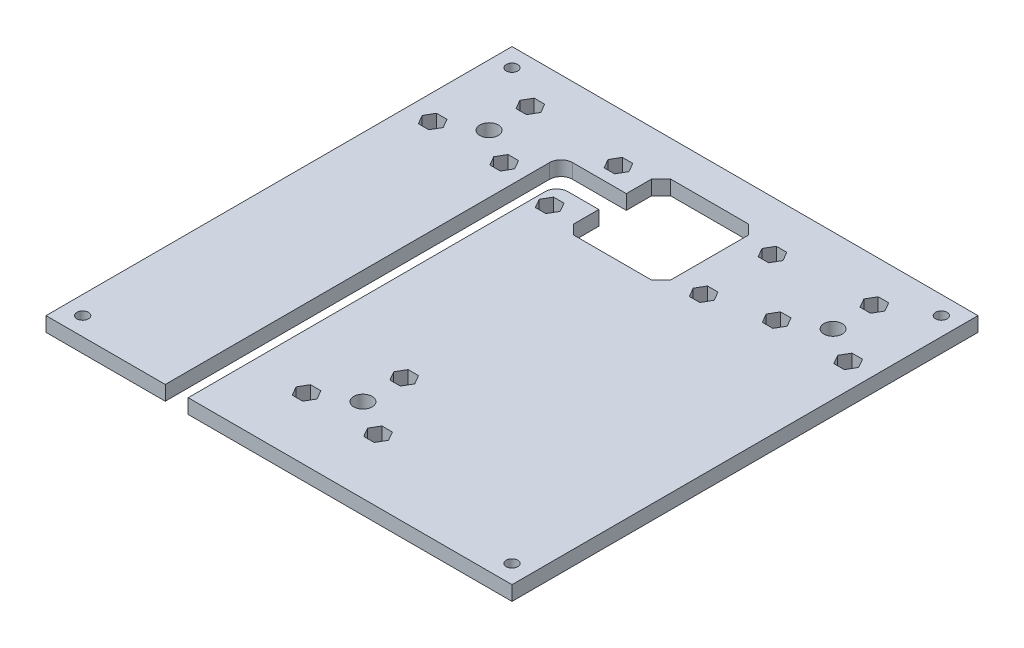
from build123d import *

# Parameters (mm, degrees)
ESQUISSE1_W              = 203.2
ESQUISSE1_H              = 203.2
BOSS_EXTRU_1_DEPTH       = 6.35
ESQUISSE2_R              = 4
ENL_V_MAT_EXTRU_1_DEPTH  = 144.824345992
ENL_V_MAT_EXTRU_2_DEPTH  = 144.824345992
ENL_V_MAT_EXTRU_3_DEPTH  = 144.824345992
CONG_1_R                 = 5
ENL_V_MAT_EXTRU_5_DEPTH  = 144.824345992
ENL_V_MAT_EXTRU_6_DEPTH  = 144.824345992
ENL_V_MAT_EXTRU_7_DEPTH  = 144.824345992
ENL_V_MAT_EXTRU_8_DEPTH  = 144.824345992
ENL_V_MAT_EXTRU_9_DEPTH  = 144.824345992
ESQUISSE11_R             = 2.5
ENL_V_MAT_EXTRU_10_DEPTH = 144.824345992


with BuildPart() as part:
    # Esquisse1 → Boss.-Extru.1 (new body)
    with BuildSketch(Plane(origin=(0, 0, 0), x_dir=(1, 0, 0), z_dir=(0, 1, 0))):
        Rectangle(ESQUISSE1_W, ESQUISSE1_H)
    extrude(amount=BOSS_EXTRU_1_DEPTH)

    # Esquisse2 → Enlèv. mat.-Extru.1 (cut, through all)
    with BuildSketch(Plane(origin=(0, 6.35, 0), x_dir=(1, 0, 0), z_dir=(0, 1, 0))):
        with Locations(Location((-75, 65, 0), (0, 0, 270))):
            Circle(ESQUISSE2_R)
        with Locations(Location((75, 65, 0), (0, 0, 270))):
            Circle(ESQUISSE2_R)
        with Locations(Location((0, -65, 0), (0, 0, 270))):
            Circle(ESQUISSE2_R)
    extrude(amount=-ENL_V_MAT_EXTRU_1_DEPTH, mode=Mode.SUBTRACT)

    # Esquisse3 → Enlèv. mat.-Extru.2 (cut, through all)
    with BuildSketch(Plane(origin=(0, 6.35, 0), x_dir=(1, 0, 0), z_dir=(0, 1, 0))):
        Polygon((-17.05, 86.15), (-21.15, 82.05), (-21.15, 47.95), (-17.05, 43.85), (17.05, 43.85), (21.15, 47.95), (21.15, 82.05), (17.05, 86.15), align=None)
    extrude(amount=-ENL_V_MAT_EXTRU_2_DEPTH, mode=Mode.SUBTRACT)

    # Esquisse4 → Enlèv. mat.-Extru.3 (cut, through all)
    with BuildSketch(Plane(origin=(0, 6.35, 0), x_dir=(1, 0, 0), z_dir=(0, 1, 0))):
        Polygon((-49.6, -101.6), (-39.6, -101.6), (-39.6, 59), (-21.15, 59), (-21.15, 71), (-49.6, 71), align=None)
    extrude(amount=-ENL_V_MAT_EXTRU_3_DEPTH, mode=Mode.SUBTRACT)

    # Congé1
    cong_1_edges = [part.edges().sort_by_distance(p)[0] for p in [
        (-49.6, 3.175, -71),
        (-39.6, 3.175, -59),
    ]]
    fillet(cong_1_edges, radius=CONG_1_R)

    # Esquisse5 → Enlèv. mat.-Extru.5 (cut, through all)
    with BuildSketch(Plane(origin=(0, 6.35, 0), x_dir=(1, 0, 0), z_dir=(0, 1, 0))):
        Polygon((-28.852385868, 49.85), (-31.138692934, 45.89), (-35.711307066, 45.89), (-37.997614132, 49.85), (-35.711307066, 53.81), (-31.138692934, 53.81), align=None)
    extrude(amount=-ENL_V_MAT_EXTRU_5_DEPTH, mode=Mode.SUBTRACT)

    # Esquisse7 → Enlèv. mat.-Extru.6 (cut, through all)
    with BuildSketch(Plane(origin=(0, 6.35, 0), x_dir=(1, 0, 0), z_dir=(0, 1, 0))):
        Polygon((-31.138692934, 75.89), (-35.711307066, 75.89), (-37.997614132, 79.85), (-35.711307066, 83.81), (-31.138692934, 83.81), (-28.852385868, 79.85), align=None)
    extrude(amount=-ENL_V_MAT_EXTRU_6_DEPTH, mode=Mode.SUBTRACT)

    # Esquisse8 → Enlèv. mat.-Extru.7 (cut, through all)
    with BuildSketch(Plane(origin=(0, 6.35, 0), x_dir=(1, 0, 0), z_dir=(0, 1, 0))):
        Polygon((36.011307066, 45.89), (31.438692934, 45.89), (29.152385868, 49.85), (31.438692934, 53.81), (36.011307066, 53.81), (38.297614132, 49.85), align=None)
    extrude(amount=-ENL_V_MAT_EXTRU_7_DEPTH, mode=Mode.SUBTRACT)

    # Esquisse9 → Enlèv. mat.-Extru.8 (cut, through all)
    with BuildSketch(Plane(origin=(0, 6.35, 0), x_dir=(1, 0, 0), z_dir=(0, 1, 0))):
        Polygon((36.011307066, 75.89), (31.438692934, 75.89), (29.152385868, 79.85), (31.438692934, 83.81), (36.011307066, 83.81), (38.297614132, 79.85), align=None)
    extrude(amount=-ENL_V_MAT_EXTRU_8_DEPTH, mode=Mode.SUBTRACT)

    # Esquisse10 → Enlèv. mat.-Extru.9 (cut, through all)
    with BuildSketch(Plane(origin=(0, 6.35, 0), x_dir=(1, 0, 0), z_dir=(0, 1, 0))):
        Polygon((20.1610714, -74), (17.874764334, -70.04), (13.302150202, -70.04), (11.015843136, -74), (13.302150202, -77.96), (17.874764334, -77.96), align=None)
        Polygon((-20.1610714, -74), (-17.874764334, -77.96), (-13.302150202, -77.96), (-11.015843136, -74), (-13.302150202, -70.04), (-17.874764334, -70.04), align=None)
        Polygon((-4.572614132, -47), (-2.286307066, -50.96), (2.286307066, -50.96), (4.572614132, -47), (2.286307066, -43.04), (-2.286307066, -43.04), align=None)
        Polygon((-63.984156864, 56), (-61.697849798, 52.04), (-57.125235666, 52.04), (-54.8389286, 56), (-57.125235666, 59.96), (-61.697849798, 59.96), align=None)
        Polygon((-95.1610714, 56), (-92.874764334, 52.04), (-88.302150202, 52.04), (-86.015843136, 56), (-88.302150202, 59.96), (-92.874764334, 59.96), align=None)
        Polygon((-79.572614132, 83), (-77.286307066, 79.04), (-72.713692934, 79.04), (-70.427385868, 83), (-72.713692934, 86.96), (-77.286307066, 86.96), align=None)
        Polygon((54.8389286, 56), (57.125235666, 52.04), (61.697849798, 52.04), (63.984156864, 56), (61.697849798, 59.96), (57.125235666, 59.96), align=None)
        Polygon((95.1610714, 56), (92.874764334, 59.96), (88.302150202, 59.96), (86.015843136, 56), (88.302150202, 52.04), (92.874764334, 52.04), align=None)
        Polygon((70.427385868, 83), (72.713692934, 79.04), (77.286307066, 79.04), (79.572614132, 83), (77.286307066, 86.96), (72.713692934, 86.96), align=None)
    extrude(amount=-ENL_V_MAT_EXTRU_9_DEPTH, mode=Mode.SUBTRACT)

    # Esquisse11 → Enlèv. mat.-Extru.10 (cut, through all)
    with BuildSketch(Plane(origin=(0, 6.35, 0), x_dir=(1, 0, 0), z_dir=(0, 1, 0))):
        with Locations(Location((93.6, 93.6, 0), (0, 0, 270))):
            Circle(ESQUISSE11_R)
        with Locations(Location((-93.6, 93.6, 0), (0, 0, 270))):
            Circle(ESQUISSE11_R)
        with Locations(Location((-93.6, -93.6, 0), (0, 0, 270))):
            Circle(ESQUISSE11_R)
        with Locations(Location((93.6, -93.6, 0), (0, 0, 270))):
            Circle(ESQUISSE11_R)
    extrude(amount=-ENL_V_MAT_EXTRU_10_DEPTH, mode=Mode.SUBTRACT)


solid = part.part
